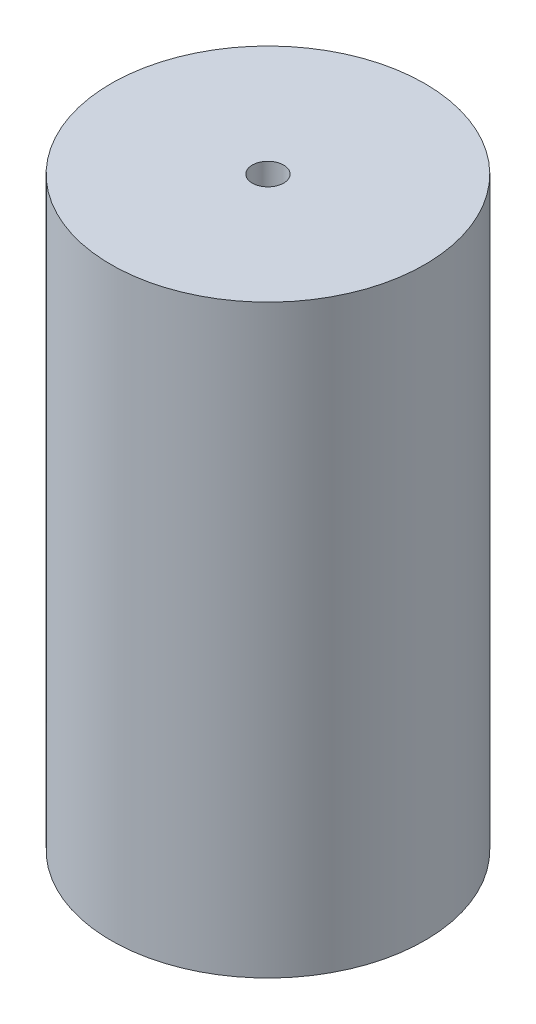
from build123d import *

# Parameters (mm, degrees)
SKETCH1_R                   = 25.527
SKETCH1_R_2                 = 19.177
BOSS_EXTRUDE1_DEPTH         = 76.2
SKETCH2_R                   = 25.527
BOSS_EXTRUDE2_DEPTH         = 19.05
TAP_DRILL_FOR_1_4_20_TAP1_D = 5.1054
FILLET1_R                   = 2.54


with BuildPart() as part:
    # Sketch1 → Boss-Extrude1 (new body)
    with BuildSketch(Plane(origin=(0, 0, 0), x_dir=(1, 0, 0), z_dir=(0, 1, 0))):
        with Locations(Location((0, 0, 0), (0, 0, 90))):
            Circle(SKETCH1_R)
        with Locations(Location((0, 0, 0), (0, 0, 90))):
            Circle(SKETCH1_R_2, mode=Mode.SUBTRACT)
    extrude(amount=BOSS_EXTRUDE1_DEPTH)

    # Sketch2 → Boss-Extrude2 (add)
    with BuildSketch(Plane(origin=(0, 76.2, 0), x_dir=(1, 0, 0), z_dir=(0, 1, 0))):
        with Locations(Location((0, 0, 0), (0, 0, 90))):
            Circle(SKETCH2_R)
    extrude(amount=BOSS_EXTRUDE2_DEPTH)

    # Tap Drill for 1/4-20 Tap1 (through all)
    with Locations(Plane.ZX.offset(95.25)):
        with Locations((0, 0)):
            Hole(TAP_DRILL_FOR_1_4_20_TAP1_D / 2)

    # Fillet1
    fillet1_edges = [part.edges().sort_by_distance(p)[0] for p in [
        (0, 0, 19.177),
    ]]
    fillet(fillet1_edges, radius=FILLET1_R)


solid = part.part
